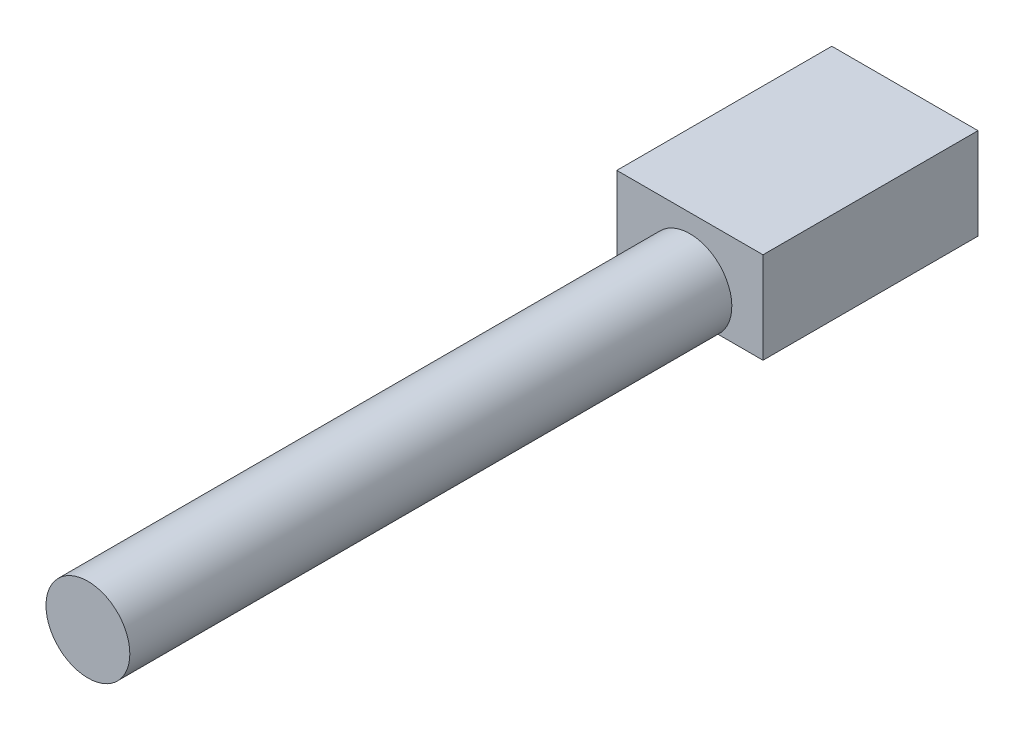
from build123d import *

# Parameters (mm, degrees)
SKETCH_1_R          = 9.75
EXTRUDE_1_DEPTH     = 140
SKETCH_2_W          = 34
SKETCH_2_H          = 24
EXTRUDE_2_DEPTH     = 50
CUT_EXTRUDE_1_REACH = 143.722


with BuildPart() as part:
    # 스케치1 → 보스-돌출1 (new body)
    with BuildSketch(Plane.XY):
        Circle(SKETCH_1_R)
    extrude(amount=EXTRUDE_1_DEPTH)

    # 스케치2 → 보스-돌출2 (add)
    with BuildSketch(Plane.XY):
        with Locations((0, 2)):
            Rectangle(SKETCH_2_W, SKETCH_2_H)
    extrude(amount=-EXTRUDE_2_DEPTH)

    # 스케치3 → 컷-돌출1 (cut, up to next)
    with BuildSketch(Plane.XY, mode=Mode.PRIVATE) as cut_extrude_1_sk1:
        with BuildLine():
            Line((-6.519202405, -7.25), (-17, -7.25))
            Line((-17, -7.25), (-17, -10))
            Line((-17, -10), (17, -10))
            Line((17, -10), (17, -7.25))
            Line((17, -7.25), (6.519202405, -7.25))
            ThreePointArc((6.519202405, -7.25), (0, -9.75), (-6.519202405, -7.25))
        make_face()
    cut_extrude_1_tool1 = extrude(cut_extrude_1_sk1.sketch, amount=-CUT_EXTRUDE_1_REACH, mode=Mode.PRIVATE) & part.part
    add(cut_extrude_1_tool1.solids().sort_by_distance((0, -9.784111, 0))[0], mode=Mode.SUBTRACT)


solid = part.part
